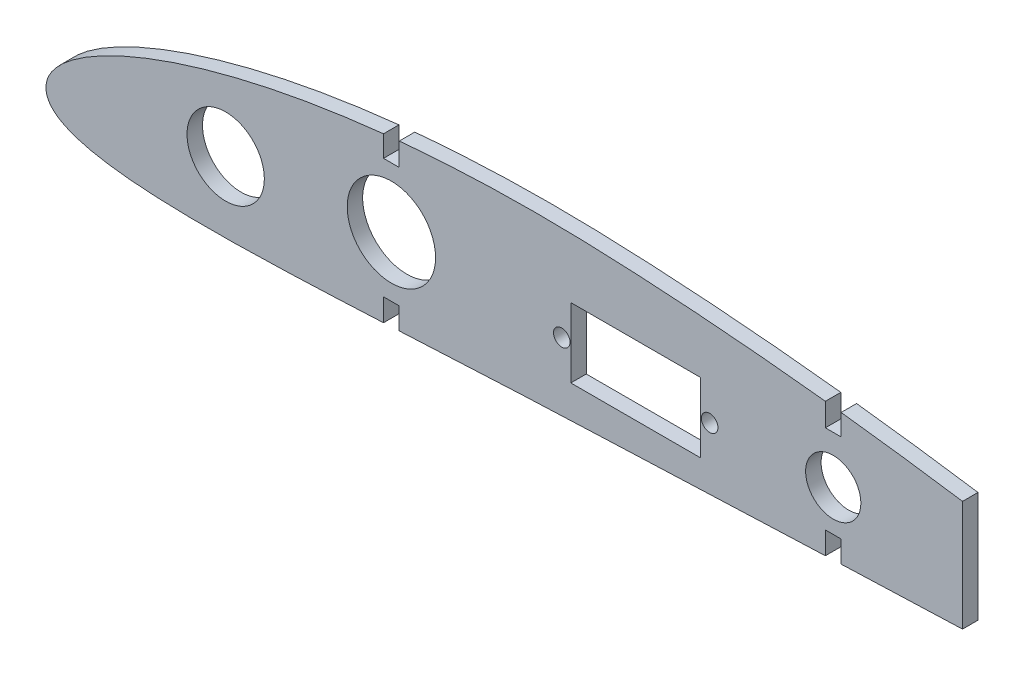
from build123d import *

# Parameters (mm, degrees)
SKETCH_1_R      = 7
SKETCH_1_R_2    = 8
SKETCH_1_R_3    = 1.5
SKETCH_1_W      = 23.5
SKETCH_1_H      = 12.6
SKETCH_1_R_4    = 5
EXTRUDE_1_DEPTH = 1.4


with BuildPart() as part:
    # Эскиз1 → Бобышка-Вытянуть1 (new, symmetric)
    with BuildSketch(Plane.XY):
        with BuildLine():
            Line((63.957619318, 19.450139662), (61.107619318, 19.450139662))
            Line((61.107619318, 19.450139662), (61.107619318, 23.303137173))
            add(Edge.make_bspline(
                [(61.107619318, 23.303137173), (59.917945614, 23.176751945), (56.739740439, 22.81448979), (51.605762688, 22.119065522), (45.744400311, 21.156564432), (39.995857594, 20.03537139), (34.397919842, 18.756316235), (29.010382103, 17.327615608), (23.925798408, 15.771864922), (19.27067884, 14.134269435), (15.179098391, 12.483335438), (11.74047579, 10.895610996), (8.959371869, 9.429577366), (6.76089118, 8.1086032), (5.033709748, 6.924638056), (3.671694933, 5.854229665), (2.592101123, 4.871305369), (1.738175668, 3.952595744), (1.06987083, 3.080946374), (0.57164541, 2.241622103), (0.215773899, 1.430785398), (0.102255581, 0.883241695), (0.047975, 0.621425001)],
                knots=[0.740090669, 0.740090669, 0.740090669, 0.740090669, 0.7539832, 0.77723469, 0.800246382, 0.822950709, 0.845237155, 0.866915896, 0.887662335, 0.906968281, 0.924203157, 0.938878975, 0.950931611, 0.960693484, 0.968646729, 0.975232933, 0.980794744, 0.985583761, 0.989781539, 0.993521313, 0.996902113, 1, 1, 1, 1], degree=3))
            add(Edge.make_bspline(
                [(0.047975, 0.621425001), (0.02271382, 0.373490086), (-0.027820789, -0.122499974), (0.077991212, -0.884434589), (0.34969565, -1.63883807), (0.814331135, -2.365068923), (1.46348078, -3.039275244), (2.290973016, -3.660999469), (3.30592875, -4.23577962), (4.535255619, -4.773674143), (6.029745688, -5.282192164), (7.868981215, -5.765316676), (10.168831391, -6.221716592), (13.075438188, -6.63961873), (16.728115362, -6.992956737), (21.189952096, -7.247345144), (26.399984415, -7.376638848), (32.197398564, -7.376256913), (38.397806759, -7.261436579), (44.857621768, -7.056641358), (51.486543096, -6.786453532), (56.920566709, -6.533358441), (60.139839208, -6.376114839), (61.107619318, -6.32836923)],
                knots=[0, 0, 0, 0, 0.002941446, 0.005884319, 0.00901613, 0.012364547, 0.016007934, 0.020036845, 0.024573728, 0.029783835, 0.03589701, 0.04324044, 0.052275965, 0.063634589, 0.077983176, 0.095698161, 0.116520086, 0.13966073, 0.16431217, 0.18991889, 0.216157201, 0.242837762, 0.254306514, 0.254306514, 0.254306514, 0.254306514], degree=3))
            Line((61.107619318, -6.32836923), (61.107619318, -2.257745247))
            Line((61.107619318, -2.257745247), (63.957619318, -2.257745247))
            Line((63.957619318, -2.257745247), (63.957619318, -6.186566126))
            add(Edge.make_bspline(
                [(63.957619318, -6.186566126), (64.317823095, -6.168514758), (66.969747676, -6.035316313), (71.910772709, -5.784005174), (78.771375576, -5.439680449), (85.610498609, -5.110951246), (92.432107589, -4.804953317), (99.25503119, -4.531981644), (106.097378404, -4.278274658), (112.96921168, -4.00308991), (119.864404254, -3.723176166), (126.773860473, -3.440067276), (133.855552455, -3.151608468), (138.633361552, -2.960411351), (141.107619318, -2.86287629)],
                knots=[0.265564796, 0.265564796, 0.265564796, 0.265564796, 0.269833583, 0.296993022, 0.324123272, 0.351139107, 0.378035509, 0.404946016, 0.431960837, 0.459078395, 0.4863474, 0.51364083, 0.540928595, 0.570237104, 0.570237104, 0.570237104, 0.570237104], degree=3))
            Line((141.107619318, -2.86287629), (141.107619318, 1.193130543))
            Line((141.107619318, 1.193130543), (143.957619318, 1.193130543))
            Line((143.957619318, 1.193130543), (143.957619318, -2.751209627))
            add(Edge.make_bspline(
                [(143.957619318, -2.751209627), (145.13020609, -2.705557458), (148.596084852, -2.571725453), (154.352602411, -2.355626415), (160.507662095, -2.135075484), (164.369425992, -2.00299999), (165.940456932, -1.950382964)],
                knots=[0.581490104, 0.581490104, 0.581490104, 0.581490104, 0.595379569, 0.622543445, 0.64967326, 0.668278692, 0.668278692, 0.668278692, 0.668278692], degree=3))
            Line((165.940456932, -1.950382964), (165.940456932, 7.49391084))
            Line((165.940456932, 7.49391084), (165.940456932, 18.08535451))
            add(Edge.make_bspline(
                [(165.940456932, 18.08535451), (165.930512987, 18.08685322), (163.740114226, 18.416932974), (159.368680729, 19.054501815), (152.821805128, 19.944885603), (147.683892721, 20.591912914), (144.728786809, 20.943344409), (143.957619318, 21.033629847)],
                knots=[0.332761263, 0.332761263, 0.332761263, 0.332761263, 0.332878042, 0.358484538, 0.384061186, 0.409602822, 0.418619192, 0.418619192, 0.418619192, 0.418619192], degree=3))
            Line((143.957619318, 21.033629847), (143.957619318, 17.19883932))
            Line((143.957619318, 17.19883932), (141.107619318, 17.19883932))
            Line((141.107619318, 17.19883932), (141.107619318, 21.360787161))
            add(Edge.make_bspline(
                [(141.107619318, 21.360787161), (140.647203073, 21.412583326), (138.008124909, 21.706530989), (133.19183673, 22.212004255), (126.658683026, 22.825721434), (120.136770918, 23.363973271), (113.62856714, 23.824677329), (107.152732037, 24.200242598), (100.741095693, 24.498399513), (94.411752715, 24.686649771), (88.155917993, 24.740095652), (81.949043055, 24.658849145), (75.780520591, 24.441013809), (69.785413798, 24.089605746), (65.850842722, 23.766532071), (63.957619318, 23.588464287)],
                knots=[0.429723551, 0.429723551, 0.429723551, 0.429723551, 0.435103874, 0.460559416, 0.485959195, 0.51130307, 0.536551515, 0.561723366, 0.586628867, 0.611085431, 0.6352512, 0.659272176, 0.683163753, 0.706922144, 0.729003809, 0.729003809, 0.729003809, 0.729003809], degree=3))
            Line((63.957619318, 23.588464287), (63.957619318, 19.450139662))
        make_face()
        with Locations((32.532619318, 5.448144701)):
            Circle(SKETCH_1_R, mode=Mode.SUBTRACT)
        with Locations((62.532619318, 8.596197208)):
            Circle(SKETCH_1_R_2, mode=Mode.SUBTRACT)
        with Locations((93.383057475, 7.493910357)):
            Circle(SKETCH_1_R_3, mode=Mode.SUBTRACT)
        with Locations((106.768057475, 7.493910357)):
            Rectangle(SKETCH_1_W, SKETCH_1_H, mode=Mode.SUBTRACT)
        with Locations((120.153057475, 7.493910357)):
            Circle(SKETCH_1_R_3, mode=Mode.SUBTRACT)
        with Locations((142.532619318, 8.596197208)):
            Circle(SKETCH_1_R_4, mode=Mode.SUBTRACT)
    extrude(amount=EXTRUDE_1_DEPTH, both=True)


solid = part.part
